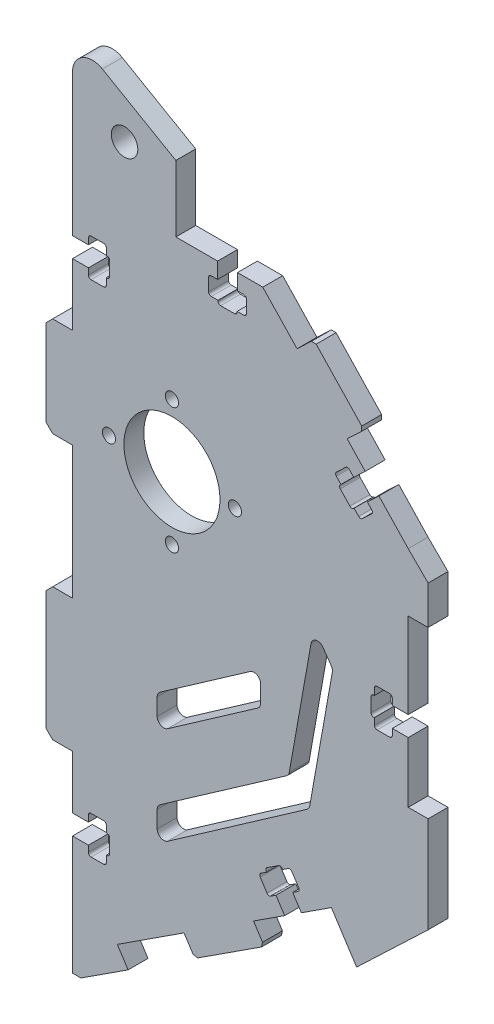
from build123d import *

# Parameters (mm, degrees)
EXTRUDE_1_DEPTH           = 3
EXTRUDE_2_DEPTH           = 3
CUT_EXTRUDE_2_DEPTH       = 10
CUT_EXTRUDE_3_DEPTH       = 10
CUT_EXTRUDE_4_DEPTH       = 10
CUT_EXTRUDE_5_DEPTH       = 10
EXTRUDE_3_DEPTH           = 3
EXTRUDE_4_DEPTH           = 3
SKETCH_12_R               = 6.95
CUT_EXTRUDE_6_DEPTH       = 10
SKETCH_15_R               = 7.25
CUT_EXTRUDE_8_DEPTH       = 10
SKETCH_16_R               = 1
CUT_EXTRUDE_9_DEPTH       = 10
SKETCH_17_W               = 8
SKETCH_17_H               = 3
CUT_EXTRUDE_10_DEPTH      = 3
CUT_EXTRUDE_11_DEPTH      = 3
SKETCH_20_W               = 3
SKETCH_20_H               = 12
EXTRUDE_6_DEPTH           = 3
EXTRUDE_8_DEPTH           = 3
SKETCH_22_W               = 3
SKETCH_22_H               = 25
CUT_EXTRUDE_12_DEPTH      = 3
SKETCH_23_W               = 3
SKETCH_23_H               = 15
SKETCH_23_H_2             = 20
EXTRUDE_9_DEPTH           = 3
CUT_EXTRUDE_15_DEPTH      = 10
FILLET_2_R                = 1
CUT_EXTRUDE_16_DEPTH      = 192.846761528
CUT_EXTRUDE_16_DEPTH_BACK = 3
CUT_EXTRUDE_17_DEPTH      = 3
CUT_EXTRUDE_18_DEPTH      = 3
CUT_EXTRUDE_19_DEPTH      = 3
SKETCH_60_W               = 12
SKETCH_60_H               = 3
CUT_EXTRUDE_51_DEPTH      = 3
EXTRUDE_10_DEPTH          = 3
EXTRUDE_11_DEPTH          = 3
SKETCH_64_R               = 2
CUT_EXTRUDE_53_DEPTH      = 150
FILLET_3_R                = 3
SKETCH_67_W               = 3
SKETCH_67_H               = 15
SKETCH_67_H_2             = 20
EXTRUDE_12_DEPTH          = 1
CHAMFER_1_SIZE            = 1
EXTRUDE_START             = -3
EXTRUDE_13_DEPTH          = 3
CUT_EXTRUDE_56_DEPTH      = 3
SKETCH_70_W               = 3
SKETCH_70_H               = 12
EXTRUDE_14_DEPTH          = 0.5
CHAMFER_4_SIZE            = 0.5
EXTRUDE_16_DEPTH          = 3
CUT_EXTRUDE_START         = -10
CUT_EXTRUDE_57_DEPTH      = 10
SKETCH_74_W               = 3.5
SKETCH_74_H               = 3
CUT_EXTRUDE_58_DEPTH      = 3
SKETCH_75_W               = 3.5
SKETCH_75_H               = 3
EXTRUDE_17_DEPTH          = 3
SKETCH_76_W               = 3.5
SKETCH_76_H               = 3
CUT_EXTRUDE_59_DEPTH      = 1
CHAMFER_5_SIZE            = 0.5
CUT_EXTRUDE_60_DEPTH      = 3
CUT_EXTRUDE_61_DEPTH      = 3


with BuildPart() as part:
    # 草图1 → 凸台-拉伸1 (new body)
    with BuildSketch(Plane.XY):
        Polygon((76.65111086, -144.127200703), (76.65111086, -91.167659031), (54.65111086, -69.167659031), (25.999999942, -69.167659031), (25.999999942, -176.167659031), (27.259933482, -176.167659031), align=None)
    extrude(amount=EXTRUDE_1_DEPTH)

    # 草图2 → 凸台-拉伸2 (add)
    with BuildSketch(Plane.XY.offset(3)):
        Polygon((76.65111086, -144.127200703), (84.65111086, -138.937535661), (84.65111086, -107.896120954), (84.65111086, -99.167659031), (76.65111086, -91.167659031), align=None)
    extrude(amount=-EXTRUDE_2_DEPTH)

    # 草图3 → 切除-拉伸2 (cut)
    with BuildSketch(Plane.XY.offset(3)):
        Polygon((82.973233852, -140.025988117), (84.65111086, -138.937535661), (84.65111086, -99.167659031), (82.65111086, -97.167659031), (82.65111086, -138.937535661), (82.65111086, -140.234951922), align=None)
    extrude(amount=-CUT_EXTRUDE_2_DEPTH, mode=Mode.SUBTRACT)

    # 草图4 → 切除-拉伸3 (cut)
    with BuildSketch(Plane.XY.offset(3)):
        Polygon((79.65111086, -94.167659031), (79.65111086, -97.167659031), (79.65111086, -142.181076312), (82.65111086, -140.234951922), (82.65111086, -97.167659031), align=None)
    extrude(amount=-CUT_EXTRUDE_3_DEPTH, mode=Mode.SUBTRACT)

    # 草图5 → 切除-拉伸4 (cut)
    with BuildSketch(Plane.XY.offset(3)):
        Polygon((78.65111086, -141.63780196), (78.65111086, -94.581872594), (78.65111086, -93.167659031), (79.65111086, -94.167659031), (79.65111086, -142.181076312), (78.65111086, -142.829784443), align=None)
    extrude(amount=-CUT_EXTRUDE_4_DEPTH, mode=Mode.SUBTRACT)

    # 草图6 → 切除-拉伸5 (cut)
    with BuildSketch(Plane.XY.offset(3)):
        Polygon((77.812172356, -143.374010671), (78.65111086, -142.829784443), (78.65111086, -93.167659031), (77.65111086, -92.167659031), (77.65111086, -93.581872594), (77.65111086, -142.28651009), (77.65111086, -143.478492573), align=None)
    extrude(amount=-CUT_EXTRUDE_5_DEPTH, mode=Mode.SUBTRACT)

    # 草图7 → 凸台-拉伸3 (add)
    with BuildSketch(Plane.XY.offset(3)):
        Polygon((79.65111086, -94.167659031), (79.65111086, -142.181076312), (77.65111086, -143.478492573), (77.65111086, -92.167659031), align=None)
    extrude(amount=-EXTRUDE_3_DEPTH)

    # 草图9 → 凸台-拉伸4 (add)
    with BuildSketch(Plane.XY.offset(3)):
        Polygon((25.999999942, -69.167659031), (55.999999942, -69.167659031), (79.65111086, -94.167659031), (79.65111086, -142.181076312), (27.259933482, -176.167659031), (25.999999942, -176.167659031), align=None)
    extrude(amount=-EXTRUDE_4_DEPTH)

    # 草图12 → 切除-拉伸6 (cut)
    with BuildSketch(Plane(origin=(-85.620742224, -166.540111436, 3), x_dir=(1, 0, 0), z_dir=(0, 0, 1))):
        with Locations((126.620742166, 63.372452405)):
            Circle(SKETCH_12_R)
    extrude(amount=-CUT_EXTRUDE_6_DEPTH, mode=Mode.SUBTRACT)

    # 草图15 → 切除-拉伸8 (cut)
    with BuildSketch(Plane.XY.offset(3)):
        with Locations((40.999999942, -103.167659031)):
            Circle(SKETCH_15_R)
    extrude(amount=-CUT_EXTRUDE_8_DEPTH, mode=Mode.SUBTRACT)

    # 草图16 → 切除-拉伸9 (cut)
    with BuildSketch(Plane.XY.offset(3)):
        with Locations((40.999999942, -112.667659031)):
            Circle(SKETCH_16_R)
        with Locations((50.499999942, -103.167659031)):
            Circle(SKETCH_16_R)
        with Locations((31.499999942, -103.167659031)):
            Circle(SKETCH_16_R)
        with Locations((40.999999942, -93.667659031)):
            Circle(SKETCH_16_R)
    extrude(amount=-CUT_EXTRUDE_9_DEPTH, mode=Mode.SUBTRACT)

    # 草图17 → 切除-拉伸10 (cut)
    with BuildSketch(Plane(origin=(0, -69.167659031, 0), x_dir=(1, 0, 0), z_dir=(0, 1, 0))):
        with Locations((29.999999942, -1.5)):
            Rectangle(SKETCH_17_W, SKETCH_17_H)
    extrude(amount=-CUT_EXTRUDE_10_DEPTH, mode=Mode.SUBTRACT)

    # 草图19 → 切除-拉伸11 (cut)
    with BuildSketch(Plane.XY.offset(3)):
        Polygon((45.999999942, -69.167659031), (45.999999942, -72.167659031), (54.7083632, -72.167659031), (76.65111086, -95.361863034), (76.65111086, -142.181076312), (76.65111086, -144.127200703), (79.65111086, -142.181076312), (79.65111086, -94.167659031), (55.999999942, -69.167659031), align=None)
    extrude(amount=-CUT_EXTRUDE_11_DEPTH, mode=Mode.SUBTRACT)

    # 草图20 → 凸台-拉伸6 (add)
    with BuildSketch(Plane(origin=(-7.158548069, -6.772304575, 0), x_dir=(0, 0, -1), z_dir=(0.726432697687951, 0.6872376122781741, 0))):
        with Locations((-1.5, -105.542592133)):
            Rectangle(SKETCH_20_W, SKETCH_20_H)
    extrude(amount=EXTRUDE_6_DEPTH)

    # 草图21 → 凸台-拉伸8 (add)
    with BuildSketch(Plane.XY.offset(3)):
        Polygon((79.65111086, -106.005849511), (79.65111086, -141.127200703), (79.65111086, -142.181076312), (76.65111086, -144.127200703), (76.65111086, -95.361863034), (79.65111086, -98.361863034), align=None)
    extrude(amount=-EXTRUDE_8_DEPTH)

    # 草图22 → 切除-拉伸12 (cut)
    with BuildSketch(Plane(origin=(-85.620742224, -166.540111436, 3), x_dir=(1, 0, 0), z_dir=(0, 0, 1))):
        with Locations((163.771853083, 49.872452405)):
            Rectangle(SKETCH_22_W, SKETCH_22_H)
        Polygon((150.676580903, 18.466910845), (138.931441854, 10.847743652), (140.564120538, 8.330928141), (152.309259588, 15.950095334), align=None)
        Polygon((120.010127201, -5.002614445), (130.077389244, 1.528100291), (128.44471056, 4.044915802), (118.377448517, -2.485798935), align=None)
    extrude(amount=-CUT_EXTRUDE_12_DEPTH, mode=Mode.SUBTRACT)

    # 草图23 → 凸台-拉伸9 (add)
    with BuildSketch(Plane.ZY.offset(-25.999999942)):
        with Locations((1.5, -99.667659031)):
            Rectangle(SKETCH_23_W, SKETCH_23_H)
        with Locations((1.5, -137.167659031)):
            Rectangle(SKETCH_23_W, SKETCH_23_H_2)
    extrude(amount=EXTRUDE_9_DEPTH)

    # 草图24 → 切除-拉伸15 (cut)
    with BuildSketch(Plane.XY.offset(3)):
        Polygon((62.409828567, -112.712939097), (65.272628358, -116.812253352), (61.717103324, -136.831405173), (38.774623861, -152.853530175), (38.774623861, -147.853530175), (58.631561343, -133.986226294), align=None)
        Polygon((54.381738207, -122.245808278), (54.381738207, -127.245808278), (38.774623861, -138.145202887), (38.774623861, -133.145202887), align=None)
    extrude(amount=-CUT_EXTRUDE_15_DEPTH, mode=Mode.SUBTRACT)

    # 圆角2
    fillet_2_edges = [part.edges().sort_by_distance(p)[0] for p in [
        (54.381738207, -122.245808278, 1.5),
        (54.381738207, -127.245808278, 1.5),
        (38.774623861, -138.145202887, 1.5),
        (38.774623861, -133.145202887, 1.5),
        (62.409828567, -112.712939097, 1.5),
        (65.272628358, -116.812253352, 1.5),
        (61.717103324, -136.831405173, 1.5),
        (38.774623861, -152.853530175, 1.5),
        (38.774623861, -147.853530175, 1.5),
        (58.631561343, -133.986226294, 1.5),
    ]]
    fillet(fillet_2_edges, radius=FILLET_2_R)

    # 草图25 → 切除-拉伸16 (cut, two sides: drawn at the far end of the back side and taken through both)
    with BuildSketch(Plane(origin=(-85.620742224, -166.540111436, 3), x_dir=(1, 0, 0), z_dir=(0, 0, 1)).offset(-CUT_EXTRUDE_16_DEPTH_BACK)):
        with BuildLine():
            Line((335.116496805, 51.619107779), (162.271853083, 51.619107779))
            Line((162.271853083, 51.619107779), (158.271853083, 51.619107779))
            Line((158.271853083, 51.619107779), (158.271853083, 53.019107779))
            ThreePointArc((158.271853083, 53.019107779), (158.183985118, 53.231239814), (157.971853083, 53.319107779))
            Line((157.971853083, 53.319107779), (155.071853083, 53.319107779))
            ThreePointArc((155.071853083, 53.319107779), (154.859721049, 53.231239814), (154.771853083, 53.019107779))
            Line((154.771853083, 53.019107779), (154.771853083, 51.569107779))
            Line((154.771853083, 51.569107779), (154.471853083, 51.569107779))
            ThreePointArc((154.471853083, 51.569107779), (154.259721049, 51.481239814), (154.171853083, 51.269107779))
            Line((154.171853083, 51.269107779), (154.171853083, 48.369107779))
            ThreePointArc((154.171853083, 48.369107779), (154.259721049, 48.156975745), (154.471853083, 48.069107779))
            Line((154.471853083, 48.069107779), (154.771853083, 48.069107779))
            Line((154.771853083, 48.069107779), (154.771853083, 46.619107779))
            ThreePointArc((154.771853083, 46.619107779), (154.859721049, 46.406975745), (155.071853083, 46.319107779))
            Line((155.071853083, 46.319107779), (157.971853083, 46.319107779))
            ThreePointArc((157.971853083, 46.319107779), (158.183985118, 46.406975745), (158.271853083, 46.619107779))
            Line((158.271853083, 46.619107779), (158.271853083, 48.019107779))
            Line((158.271853083, 48.019107779), (162.271853083, 48.019107779))
            Line((162.271853083, 48.019107779), (335.116496805, 48.019107779))
            Line((335.116496805, 48.019107779), (680.805784249, 48.019107779))
            Line((680.805784249, 48.019107779), (680.805784249, 51.619107779))
            Line((680.805784249, 51.619107779), (335.116496805, 51.619107779))
        make_face()
    extrude(amount=CUT_EXTRUDE_16_DEPTH + CUT_EXTRUDE_16_DEPTH_BACK, mode=Mode.SUBTRACT)

    # 草图26 → 切除-拉伸17 (cut)
    with BuildSketch(Plane(origin=(-85.620742224, -166.540111436, 3), x_dir=(1, 0, 0), z_dir=(0, 0, 1))):
        with BuildLine():
            Line((144.698749764, 17.568999389), (146.059315334, 15.47165313))
            Line((146.059315334, 15.47165313), (143.710287524, 13.947819691))
            Line((143.710287524, 13.947819691), (142.349721954, 16.04516595))
            Line((142.349721954, 16.04516595), (141.468836525, 15.473728411))
            ThreePointArc((141.468836525, 15.473728411), (141.243050742, 15.431996413), (141.053887105, 15.562142093))
            Line((141.053887105, 15.562142093), (140.019857272, 17.15612525))
            ThreePointArc((140.019857272, 17.15612525), (139.978125275, 17.381911033), (140.108270955, 17.57107467))
            Line((140.108270955, 17.57107467), (141.031103309, 18.16972352))
            Line((141.031103309, 18.16972352), (140.922258063, 18.337511221))
            ThreePointArc((140.922258063, 18.337511221), (140.880526066, 18.563297004), (141.010671746, 18.752460641))
            Line((141.010671746, 18.752460641), (142.772442603, 19.89533572))
            ThreePointArc((142.772442603, 19.89533572), (142.998228386, 19.937067717), (143.187392023, 19.806922037))
            Line((143.187392023, 19.806922037), (143.296237268, 19.639134336))
            Line((143.296237268, 19.639134336), (144.219069622, 20.237783187))
            ThreePointArc((144.219069622, 20.237783187), (144.444855405, 20.279515184), (144.634019042, 20.149369504))
            Line((144.634019042, 20.149369504), (145.668048875, 18.555386348))
            ThreePointArc((145.668048875, 18.555386348), (145.709780872, 18.329600565), (145.579635192, 18.140436928))
            Line((145.579635192, 18.140436928), (144.698749764, 17.568999389))
        make_face()
    extrude(amount=-CUT_EXTRUDE_17_DEPTH, mode=Mode.SUBTRACT)

    # 草图27 → 切除-拉伸18 (cut)
    with BuildSketch(Plane(origin=(-85.620742224, -166.540111436, 0), x_dir=(-1, 0, 0), z_dir=(0, 0, -1))):
        with BuildLine():
            Line((-114.120742166, 8.402522263), (-111.620742166, 8.402522263))
            Line((-111.620742166, 8.402522263), (-111.620742166, 11.202522263))
            Line((-111.620742166, 11.202522263), (-114.120742166, 11.202522263))
            Line((-114.120742166, 11.202522263), (-114.120742166, 12.252522263))
            ThreePointArc((-114.120742166, 12.252522263), (-114.208610132, 12.464654297), (-114.420742166, 12.552522263))
            Line((-114.420742166, 12.552522263), (-116.320742166, 12.552522263))
            ThreePointArc((-116.320742166, 12.552522263), (-116.5328742, 12.464654297), (-116.620742166, 12.252522263))
            Line((-116.620742166, 12.252522263), (-116.620742166, 11.152522263))
            Line((-116.620742166, 11.152522263), (-116.820742166, 11.152522263))
            ThreePointArc((-116.820742166, 11.152522263), (-117.0328742, 11.064654297), (-117.120742166, 10.852522263))
            Line((-117.120742166, 10.852522263), (-117.120742166, 8.752522263))
            ThreePointArc((-117.120742166, 8.752522263), (-117.0328742, 8.540390228), (-116.820742166, 8.452522263))
            Line((-116.820742166, 8.452522263), (-116.620742166, 8.452522263))
            Line((-116.620742166, 8.452522263), (-116.620742166, 7.352522263))
            ThreePointArc((-116.620742166, 7.352522263), (-116.5328742, 7.140390228), (-116.320742166, 7.052522263))
            Line((-116.320742166, 7.052522263), (-114.420742166, 7.052522263))
            ThreePointArc((-114.420742166, 7.052522263), (-114.208610132, 7.140390228), (-114.120742166, 7.352522263))
            Line((-114.120742166, 7.352522263), (-114.120742166, 8.402522263))
        make_face()
        with BuildLine():
            Line((-114.120742166, 83.845595622), (-111.620742166, 83.845595622))
            Line((-111.620742166, 83.845595622), (-111.620742166, 86.645595622))
            Line((-111.620742166, 86.645595622), (-114.120742166, 86.645595622))
            Line((-114.120742166, 86.645595622), (-114.120742166, 87.695595622))
            ThreePointArc((-114.120742166, 87.695595622), (-114.208610132, 87.907727656), (-114.420742166, 87.995595622))
            Line((-114.420742166, 87.995595622), (-116.320742166, 87.995595622))
            ThreePointArc((-116.320742166, 87.995595622), (-116.5328742, 87.907727656), (-116.620742166, 87.695595622))
            Line((-116.620742166, 87.695595622), (-116.620742166, 86.595595622))
            Line((-116.620742166, 86.595595622), (-116.820742166, 86.595595622))
            ThreePointArc((-116.820742166, 86.595595622), (-117.0328742, 86.507727656), (-117.120742166, 86.295595622))
            Line((-117.120742166, 86.295595622), (-117.120742166, 84.195595622))
            ThreePointArc((-117.120742166, 84.195595622), (-117.0328742, 83.983463588), (-116.820742166, 83.895595622))
            Line((-116.820742166, 83.895595622), (-116.620742166, 83.895595622))
            Line((-116.620742166, 83.895595622), (-116.620742166, 82.795595622))
            ThreePointArc((-116.620742166, 82.795595622), (-116.5328742, 82.583463588), (-116.320742166, 82.495595622))
            Line((-116.320742166, 82.495595622), (-114.420742166, 82.495595622))
            ThreePointArc((-114.420742166, 82.495595622), (-114.208610132, 82.583463588), (-114.120742166, 82.795595622))
            Line((-114.120742166, 82.795595622), (-114.120742166, 83.845595622))
        make_face()
    extrude(amount=-CUT_EXTRUDE_18_DEPTH, mode=Mode.SUBTRACT)

    # 草图28 → 切除-拉伸19 (cut)
    with BuildSketch(Plane(origin=(-85.620742224, -166.540111436, 0), x_dir=(-1, 0, 0), z_dir=(0, 0, -1))):
        with BuildLine():
            Line((-136.408876052, 91.872452405), (-136.408876052, 94.372452405))
            Line((-136.408876052, 94.372452405), (-133.608876052, 94.372452405))
            Line((-133.608876052, 94.372452405), (-133.608876052, 91.872452405))
            Line((-133.608876052, 91.872452405), (-132.558876052, 91.872452405))
            ThreePointArc((-132.558876052, 91.872452405), (-132.346744018, 91.784584439), (-132.258876052, 91.572452405))
            Line((-132.258876052, 91.572452405), (-132.258876052, 89.672452405))
            ThreePointArc((-132.258876052, 89.672452405), (-132.346744018, 89.460320371), (-132.558876052, 89.372452405))
            Line((-132.558876052, 89.372452405), (-133.658876052, 89.372452405))
            Line((-133.658876052, 89.372452405), (-133.658876052, 89.172452405))
            ThreePointArc((-133.658876052, 89.172452405), (-133.746744018, 88.960320371), (-133.958876052, 88.872452405))
            Line((-133.958876052, 88.872452405), (-136.058876052, 88.872452405))
            ThreePointArc((-136.058876052, 88.872452405), (-136.271008086, 88.960320371), (-136.358876052, 89.172452405))
            Line((-136.358876052, 89.172452405), (-136.358876052, 89.372452405))
            Line((-136.358876052, 89.372452405), (-137.458876052, 89.372452405))
            ThreePointArc((-137.458876052, 89.372452405), (-137.671008086, 89.460320371), (-137.758876052, 89.672452405))
            Line((-137.758876052, 89.672452405), (-137.758876052, 91.572452405))
            ThreePointArc((-137.758876052, 91.572452405), (-137.671008086, 91.784584439), (-137.458876052, 91.872452405))
            Line((-137.458876052, 91.872452405), (-136.408876052, 91.872452405))
        make_face()
    extrude(amount=-CUT_EXTRUDE_19_DEPTH, mode=Mode.SUBTRACT)

    # 草图60 → 切除-拉伸51 (cut)
    with BuildSketch(Plane(origin=(0, -69.167659031, 0), x_dir=(1, 0, 0), z_dir=(0, 1, 0))):
        with Locations((39.999999942, -1.5)):
            Rectangle(SKETCH_60_W, SKETCH_60_H)
    extrude(amount=-CUT_EXTRUDE_51_DEPTH, mode=Mode.SUBTRACT)

    # 草图61 → 凸台-拉伸10 (add)
    with BuildSketch(Plane(origin=(0, 0, 0), x_dir=(-1, 0, 0), z_dir=(0, 0, -1))):
        Polygon((-25.999999942, -72.167659031), (-25.999999942, -54.167659031), (-41.58845721, -63.167659031), (-41.58845721, -72.167659031), align=None)
    extrude(amount=-EXTRUDE_10_DEPTH)

    # 草图62 → 凸台-拉伸11 (add)
    with BuildSketch(Plane(origin=(0, 0, 0), x_dir=(-1, 0, 0), z_dir=(0, 0, -1))):
        Polygon((-25.999999942, -54.167659031), (-25.999999942, -53.167659031), (-41.58845721, -62.167659031), (-41.58845721, -63.167659031), align=None)
    extrude(amount=-EXTRUDE_11_DEPTH)

    # 草图64 → 切除-拉伸53 (cut)
    with BuildSketch(Plane(origin=(-85.620742224, -166.540111436, -5), x_dir=(-1, 0, 0), z_dir=(0, 0, -1))):
        with Locations((-119.468439353, 102.928528754)):
            Circle(SKETCH_64_R)
    extrude(amount=-CUT_EXTRUDE_53_DEPTH, mode=Mode.SUBTRACT)

    # 圆角3
    fillet_3_edges = [part.edges().sort_by_distance(p)[0] for p in [
        (25.999999942, -53.167659031, 1.5),
    ]]
    fillet(fillet_3_edges, radius=FILLET_3_R)

    # 草图67 → 凸台-拉伸12 (add)
    with BuildSketch(Plane.ZY.offset(-22.999999942)):
        with Locations((1.5, -99.667659031)):
            Rectangle(SKETCH_67_W, SKETCH_67_H)
        with Locations((1.5, -137.167659031)):
            Rectangle(SKETCH_67_W, SKETCH_67_H_2)
    extrude(amount=EXTRUDE_12_DEPTH)

    # 倒角1
    chamfer_1_edges = [part.edges().sort_by_distance(p)[0] for p in [
        (21.999999942, -107.167659031, 1.5),
        (21.999999942, -92.167659031, 1.5),
        (21.999999942, -127.167659031, 1.5),
        (21.999999942, -147.167659031, 1.5),
    ]]
    chamfer(chamfer_1_edges, length=CHAMFER_1_SIZE)

    # 草图68 → 凸台-拉伸13 (add)
    with BuildSketch(Plane.XY.offset(3).offset(EXTRUDE_START)):
        with BuildLine():
            Line((76.65111086, -114.921003657), (72.65111086, -114.921003657))
            Line((72.65111086, -114.921003657), (72.65111086, -113.521003657))
            ThreePointArc((72.65111086, -113.521003657), (72.563242894, -113.308871623), (72.35111086, -113.221003657))
            Line((72.35111086, -113.221003657), (69.45111086, -113.221003657))
            ThreePointArc((69.45111086, -113.221003657), (69.238978825, -113.308871623), (69.15111086, -113.521003657))
            Line((69.15111086, -113.521003657), (69.15111086, -114.971003657))
            Line((69.15111086, -114.971003657), (68.85111086, -114.971003657))
            ThreePointArc((68.85111086, -114.971003657), (68.638978825, -115.058871623), (68.55111086, -115.271003657))
            Line((68.55111086, -115.271003657), (68.55111086, -118.171003657))
            ThreePointArc((68.55111086, -118.171003657), (68.638978825, -118.383135691), (68.85111086, -118.471003657))
            Line((68.85111086, -118.471003657), (69.15111086, -118.471003657))
            Line((69.15111086, -118.471003657), (69.15111086, -119.921003657))
            ThreePointArc((69.15111086, -119.921003657), (69.238978825, -120.133135691), (69.45111086, -120.221003657))
            Line((69.45111086, -120.221003657), (72.35111086, -120.221003657))
            ThreePointArc((72.35111086, -120.221003657), (72.563242894, -120.133135691), (72.65111086, -119.921003657))
            Line((72.65111086, -119.921003657), (72.65111086, -118.521003657))
            Line((72.65111086, -118.521003657), (76.65111086, -118.521003657))
            Line((76.65111086, -118.521003657), (76.65111086, -114.921003657))
        make_face()
    extrude(amount=EXTRUDE_13_DEPTH)

    # 草图69 → 切除-拉伸56 (cut)
    with BuildSketch(Plane(origin=(-85.620742224, -166.540111436, 3), x_dir=(1, 0, 0), z_dir=(0, 0, 1))):
        with BuildLine():
            Line((162.271853083, 49.387065257), (159.771853083, 49.387065257))
            Line((159.771853083, 49.387065257), (159.771853083, 50.437065257))
            ThreePointArc((159.771853083, 50.437065257), (159.683985118, 50.649197291), (159.471853083, 50.737065257))
            Line((159.471853083, 50.737065257), (157.571853083, 50.737065257))
            ThreePointArc((157.571853083, 50.737065257), (157.359721049, 50.649197291), (157.271853083, 50.437065257))
            Line((157.271853083, 50.437065257), (157.271853083, 49.337065257))
            Line((157.271853083, 49.337065257), (157.071853083, 49.337065257))
            ThreePointArc((157.071853083, 49.337065257), (156.859721049, 49.249197291), (156.771853083, 49.037065257))
            Line((156.771853083, 49.037065257), (156.771853083, 46.937065257))
            ThreePointArc((156.771853083, 46.937065257), (156.859721049, 46.724933222), (157.071853083, 46.637065257))
            Line((157.071853083, 46.637065257), (157.271853083, 46.637065257))
            Line((157.271853083, 46.637065257), (157.271853083, 45.537065257))
            ThreePointArc((157.271853083, 45.537065257), (157.359721049, 45.324933222), (157.571853083, 45.237065257))
            Line((157.571853083, 45.237065257), (159.471853083, 45.237065257))
            ThreePointArc((159.471853083, 45.237065257), (159.683985118, 45.324933222), (159.771853083, 45.537065257))
            Line((159.771853083, 45.537065257), (159.771853083, 46.587065257))
            Line((159.771853083, 46.587065257), (162.271853083, 46.587065257))
            Line((162.271853083, 46.587065257), (162.271853083, 49.387065257))
        make_face()
    extrude(amount=-CUT_EXTRUDE_56_DEPTH, mode=Mode.SUBTRACT)

    # 草图70 → 凸台-拉伸14 (add)
    with BuildSketch(Plane(origin=(-4.979249976, -4.710591738, 0), x_dir=(0, 0, -1), z_dir=(0.7264326976879508, 0.6872376122781745, 0))):
        with Locations((-1.5, -105.542592133)):
            Rectangle(SKETCH_70_W, SKETCH_70_H)
    extrude(amount=EXTRUDE_14_DEPTH)

    # 倒角4
    chamfer_4_edges = [part.edges().sort_by_distance(p)[0] for p in [
        (54.943378314, -158.209183295, 1.5),
        (44.45664702, -165.012011145, 1.5),
    ]]
    chamfer(chamfer_4_edges, length=CHAMFER_4_SIZE)

    # 草图72 → 凸台-拉伸16 (add)
    with BuildSketch(Plane.XY.offset(3)):
        Polygon((79.65111086, -142.181076312), (79.65111086, -143.681076312), (68.865422276, -153.945770117), (66.688517364, -150.590016102), align=None)
    extrude(amount=-EXTRUDE_16_DEPTH)

    # 草图73 → 切除-拉伸57 (cut)
    with BuildSketch(Plane.XY.offset(3).offset(CUT_EXTRUDE_START)):
        with BuildLine():
            Line((52.138133828, -74.967659031), (52.138133828, -76.867659031))
            ThreePointArc((52.138133828, -76.867659031), (52.050265862, -77.079791066), (51.838133828, -77.167659031))
            Line((51.838133828, -77.167659031), (50.738133828, -77.167659031))
            Line((50.738133828, -77.167659031), (50.738133828, -77.367659031))
            ThreePointArc((50.738133828, -77.367659031), (50.650265862, -77.579791066), (50.438133828, -77.667659031))
            Line((50.438133828, -77.667659031), (48.338133828, -77.667659031))
            ThreePointArc((48.338133828, -77.667659031), (48.126001794, -77.579791066), (48.038133828, -77.367659031))
            Line((48.038133828, -77.367659031), (48.038133828, -77.167659031))
            Line((48.038133828, -77.167659031), (46.938133828, -77.167659031))
            ThreePointArc((46.938133828, -77.167659031), (46.726001794, -77.079791066), (46.638133828, -76.867659031))
            Line((46.638133828, -76.867659031), (46.638133828, -74.967659031))
            ThreePointArc((46.638133828, -74.967659031), (46.726001794, -74.755526997), (46.938133828, -74.667659031))
            Line((46.938133828, -74.667659031), (47.988133828, -74.667659031))
            Line((47.988133828, -74.667659031), (47.988133828, -72.167659031))
            Line((47.988133828, -72.167659031), (47.888133828, -72.167659031))
            Line((47.888133828, -72.167659031), (47.888133828, -74.567659031))
            Line((47.888133828, -74.567659031), (46.938133828, -74.567659031))
            ThreePointArc((46.938133828, -74.567659031), (46.655291116, -74.684816319), (46.538133828, -74.967659031))
            Line((46.538133828, -74.967659031), (46.538133828, -76.867659031))
            ThreePointArc((46.538133828, -76.867659031), (46.655291116, -77.150501744), (46.938133828, -77.267659031))
            Line((46.938133828, -77.267659031), (47.938133828, -77.267659031))
            Line((47.938133828, -77.267659031), (47.938133828, -77.367659031))
            ThreePointArc((47.938133828, -77.367659031), (48.055291116, -77.650501744), (48.338133828, -77.767659031))
            Line((48.338133828, -77.767659031), (50.438133828, -77.767659031))
            ThreePointArc((50.438133828, -77.767659031), (50.720976541, -77.650501744), (50.838133828, -77.367659031))
            Line((50.838133828, -77.367659031), (50.838133828, -77.267659031))
            Line((50.838133828, -77.267659031), (51.838133828, -77.267659031))
            ThreePointArc((51.838133828, -77.267659031), (52.120976541, -77.150501744), (52.238133828, -76.867659031))
            Line((52.238133828, -76.867659031), (52.238133828, -74.967659031))
            ThreePointArc((52.238133828, -74.967659031), (52.120976541, -74.684816319), (51.838133828, -74.567659031))
            Line((51.838133828, -74.567659031), (50.888133828, -74.567659031))
            Line((50.888133828, -74.567659031), (50.888133828, -72.167659031))
            Line((50.888133828, -72.167659031), (50.788133828, -72.167659031))
            Line((50.788133828, -72.167659031), (50.788133828, -74.667659031))
            Line((50.788133828, -74.667659031), (51.838133828, -74.667659031))
            ThreePointArc((51.838133828, -74.667659031), (52.050265862, -74.755526997), (52.138133828, -74.967659031))
        make_face()
        with BuildLine():
            Line((25.999999942, -79.894515814), (28.499999942, -79.894515814))
            Line((28.499999942, -79.894515814), (28.499999942, -78.844515814))
            ThreePointArc((28.499999942, -78.844515814), (28.587867908, -78.63238378), (28.799999942, -78.544515814))
            Line((28.799999942, -78.544515814), (30.699999942, -78.544515814))
            ThreePointArc((30.699999942, -78.544515814), (30.912131977, -78.63238378), (30.999999942, -78.844515814))
            Line((30.999999942, -78.844515814), (30.999999942, -79.944515814))
            Line((30.999999942, -79.944515814), (31.199999942, -79.944515814))
            ThreePointArc((31.199999942, -79.944515814), (31.412131977, -80.03238378), (31.499999942, -80.244515814))
            Line((31.499999942, -80.244515814), (31.499999942, -82.344515814))
            ThreePointArc((31.499999942, -82.344515814), (31.412131977, -82.556647849), (31.199999942, -82.644515814))
            Line((31.199999942, -82.644515814), (30.999999942, -82.644515814))
            Line((30.999999942, -82.644515814), (30.999999942, -83.744515814))
            ThreePointArc((30.999999942, -83.744515814), (30.912131977, -83.956647849), (30.699999942, -84.044515814))
            Line((30.699999942, -84.044515814), (28.799999942, -84.044515814))
            ThreePointArc((28.799999942, -84.044515814), (28.587867908, -83.956647849), (28.499999942, -83.744515814))
            Line((28.499999942, -83.744515814), (28.499999942, -82.694515814))
            Line((28.499999942, -82.694515814), (25.999999942, -82.694515814))
            Line((25.999999942, -82.694515814), (25.999999942, -82.794515814))
            Line((25.999999942, -82.794515814), (28.399999942, -82.794515814))
            Line((28.399999942, -82.794515814), (28.399999942, -83.744515814))
            ThreePointArc((28.399999942, -83.744515814), (28.51715723, -84.027358527), (28.799999942, -84.144515814))
            Line((28.799999942, -84.144515814), (30.699999942, -84.144515814))
            ThreePointArc((30.699999942, -84.144515814), (30.982842655, -84.027358527), (31.099999942, -83.744515814))
            Line((31.099999942, -83.744515814), (31.099999942, -82.744515814))
            Line((31.099999942, -82.744515814), (31.199999942, -82.744515814))
            ThreePointArc((31.199999942, -82.744515814), (31.482842655, -82.627358527), (31.599999942, -82.344515814))
            Line((31.599999942, -82.344515814), (31.599999942, -80.244515814))
            ThreePointArc((31.599999942, -80.244515814), (31.482842655, -79.961673102), (31.199999942, -79.844515814))
            Line((31.199999942, -79.844515814), (31.099999942, -79.844515814))
            Line((31.099999942, -79.844515814), (31.099999942, -78.844515814))
            ThreePointArc((31.099999942, -78.844515814), (30.982842655, -78.561673102), (30.699999942, -78.444515814))
            Line((30.699999942, -78.444515814), (28.799999942, -78.444515814))
            ThreePointArc((28.799999942, -78.444515814), (28.51715723, -78.561673102), (28.399999942, -78.844515814))
            Line((28.399999942, -78.844515814), (28.399999942, -79.794515814))
            Line((28.399999942, -79.794515814), (25.999999942, -79.794515814))
            Line((25.999999942, -79.794515814), (25.999999942, -79.894515814))
        make_face()
        with BuildLine():
            Line((25.999999942, -155.337589174), (28.499999942, -155.337589174))
            Line((28.499999942, -155.337589174), (28.499999942, -154.287589174))
            ThreePointArc((28.499999942, -154.287589174), (28.587867908, -154.07545714), (28.799999942, -153.987589174))
            Line((28.799999942, -153.987589174), (30.699999942, -153.987589174))
            ThreePointArc((30.699999942, -153.987589174), (30.912131977, -154.07545714), (30.999999942, -154.287589174))
            Line((30.999999942, -154.287589174), (30.999999942, -155.387589174))
            Line((30.999999942, -155.387589174), (31.199999942, -155.387589174))
            ThreePointArc((31.199999942, -155.387589174), (31.412131977, -155.47545714), (31.499999942, -155.687589174))
            Line((31.499999942, -155.687589174), (31.499999942, -157.787589174))
            ThreePointArc((31.499999942, -157.787589174), (31.412131977, -157.999721208), (31.199999942, -158.087589174))
            Line((31.199999942, -158.087589174), (30.999999942, -158.087589174))
            Line((30.999999942, -158.087589174), (30.999999942, -159.187589174))
            ThreePointArc((30.999999942, -159.187589174), (30.912131977, -159.399721208), (30.699999942, -159.487589174))
            Line((30.699999942, -159.487589174), (28.799999942, -159.487589174))
            ThreePointArc((28.799999942, -159.487589174), (28.587867908, -159.399721208), (28.499999942, -159.187589174))
            Line((28.499999942, -159.187589174), (28.499999942, -158.137589174))
            Line((28.499999942, -158.137589174), (25.999999942, -158.137589174))
            Line((25.999999942, -158.137589174), (25.999999942, -158.237589174))
            Line((25.999999942, -158.237589174), (28.399999942, -158.237589174))
            Line((28.399999942, -158.237589174), (28.399999942, -159.187589174))
            ThreePointArc((28.399999942, -159.187589174), (28.51715723, -159.470431886), (28.799999942, -159.587589174))
            Line((28.799999942, -159.587589174), (30.699999942, -159.587589174))
            ThreePointArc((30.699999942, -159.587589174), (30.982842655, -159.470431886), (31.099999942, -159.187589174))
            Line((31.099999942, -159.187589174), (31.099999942, -158.187589174))
            Line((31.099999942, -158.187589174), (31.199999942, -158.187589174))
            ThreePointArc((31.199999942, -158.187589174), (31.482842655, -158.070431886), (31.599999942, -157.787589174))
            Line((31.599999942, -157.787589174), (31.599999942, -155.687589174))
            ThreePointArc((31.599999942, -155.687589174), (31.482842655, -155.404746461), (31.199999942, -155.287589174))
            Line((31.199999942, -155.287589174), (31.099999942, -155.287589174))
            Line((31.099999942, -155.287589174), (31.099999942, -154.287589174))
            ThreePointArc((31.099999942, -154.287589174), (30.982842655, -154.004746461), (30.699999942, -153.887589174))
            Line((30.699999942, -153.887589174), (28.799999942, -153.887589174))
            ThreePointArc((28.799999942, -153.887589174), (28.51715723, -154.004746461), (28.399999942, -154.287589174))
            Line((28.399999942, -154.287589174), (28.399999942, -155.237589174))
            Line((28.399999942, -155.237589174), (25.999999942, -155.237589174))
            Line((25.999999942, -155.237589174), (25.999999942, -155.337589174))
        make_face()
        with BuildLine():
            Line((56.72897973, -150.494945486), (58.0895453, -152.592291745))
            Line((58.0895453, -152.592291745), (58.00565145, -152.646714368))
            Line((58.00565145, -152.646714368), (56.699508502, -150.633261959))
            Line((56.699508502, -150.633261959), (55.902516924, -151.150276876))
            ThreePointArc((55.902516924, -151.150276876), (55.601469213, -151.205919539), (55.349251031, -151.032391966))
            Line((55.349251031, -151.032391966), (54.315221198, -149.438408809))
            ThreePointArc((54.315221198, -149.438408809), (54.259578535, -149.137361098), (54.433106108, -148.885142916))
            Line((54.433106108, -148.885142916), (55.272044612, -148.340916688))
            Line((55.272044612, -148.340916688), (55.217621989, -148.257022838))
            ThreePointArc((55.217621989, -148.257022838), (55.161979326, -147.955975127), (55.335506899, -147.703756945))
            Line((55.335506899, -147.703756945), (57.097277757, -146.560881867))
            ThreePointArc((57.097277757, -146.560881867), (57.398325467, -146.505239203), (57.650543649, -146.678766777))
            Line((57.650543649, -146.678766777), (57.704966272, -146.762660627))
            Line((57.704966272, -146.762660627), (58.543904776, -146.218434399))
            ThreePointArc((58.543904776, -146.218434399), (58.844952486, -146.162791736), (59.097170668, -146.336319309))
            Line((59.097170668, -146.336319309), (60.131200501, -147.930302466))
            ThreePointArc((60.131200501, -147.930302466), (60.186843165, -148.231350177), (60.013315591, -148.483568359))
            Line((60.013315591, -148.483568359), (59.216324013, -149.000583275))
            Line((59.216324013, -149.000583275), (60.52246696, -151.014035684))
            Line((60.52246696, -151.014035684), (60.43857311, -151.068458307))
            Line((60.43857311, -151.068458307), (59.07800754, -148.971112048))
            Line((59.07800754, -148.971112048), (59.958892968, -148.399674508))
            ThreePointArc((59.958892968, -148.399674508), (60.089038648, -148.210510872), (60.047306651, -147.984725089))
            Line((60.047306651, -147.984725089), (59.013276818, -146.390741932))
            ThreePointArc((59.013276818, -146.390741932), (58.824113181, -146.260596252), (58.598327398, -146.302328249))
            Line((58.598327398, -146.302328249), (57.675495044, -146.9009771))
            Line((57.675495044, -146.9009771), (57.566649799, -146.7331894))
            ThreePointArc((57.566649799, -146.7331894), (57.377486162, -146.60304372), (57.151700379, -146.644775717))
            Line((57.151700379, -146.644775717), (55.389929522, -147.787650796))
            ThreePointArc((55.389929522, -147.787650796), (55.259783842, -147.976814432), (55.301515839, -148.202600215))
            Line((55.301515839, -148.202600215), (55.410361085, -148.370387916))
            Line((55.410361085, -148.370387916), (54.487528731, -148.969036767))
            ThreePointArc((54.487528731, -148.969036767), (54.357383051, -149.158200403), (54.399115048, -149.383986186))
            Line((54.399115048, -149.383986186), (55.433144882, -150.977969343))
            ThreePointArc((55.433144882, -150.977969343), (55.622308518, -151.108115023), (55.848094301, -151.066383026))
            Line((55.848094301, -151.066383026), (56.72897973, -150.494945486))
        make_face()
        with BuildLine():
            Line((74.15111086, -119.95304618), (76.65111086, -119.95304618))
            Line((76.65111086, -119.95304618), (76.65111086, -120.05304618))
            Line((76.65111086, -120.05304618), (74.25111086, -120.05304618))
            Line((74.25111086, -120.05304618), (74.25111086, -121.00304618))
            ThreePointArc((74.25111086, -121.00304618), (74.133953572, -121.285888892), (73.85111086, -121.40304618))
            Line((73.85111086, -121.40304618), (71.95111086, -121.40304618))
            ThreePointArc((71.95111086, -121.40304618), (71.668268147, -121.285888892), (71.55111086, -121.00304618))
            Line((71.55111086, -121.00304618), (71.55111086, -120.00304618))
            Line((71.55111086, -120.00304618), (71.45111086, -120.00304618))
            ThreePointArc((71.45111086, -120.00304618), (71.168268147, -119.885888892), (71.05111086, -119.60304618))
            Line((71.05111086, -119.60304618), (71.05111086, -117.50304618))
            ThreePointArc((71.05111086, -117.50304618), (71.168268147, -117.220203467), (71.45111086, -117.10304618))
            Line((71.45111086, -117.10304618), (71.55111086, -117.10304618))
            Line((71.55111086, -117.10304618), (71.55111086, -116.10304618))
            ThreePointArc((71.55111086, -116.10304618), (71.668268147, -115.820203467), (71.95111086, -115.70304618))
            Line((71.95111086, -115.70304618), (73.85111086, -115.70304618))
            ThreePointArc((73.85111086, -115.70304618), (74.133953572, -115.820203467), (74.25111086, -116.10304618))
            Line((74.25111086, -116.10304618), (74.25111086, -117.05304618))
            Line((74.25111086, -117.05304618), (76.65111086, -117.05304618))
            Line((76.65111086, -117.05304618), (76.65111086, -117.15304618))
            Line((76.65111086, -117.15304618), (74.15111086, -117.15304618))
            Line((74.15111086, -117.15304618), (74.15111086, -116.10304618))
            ThreePointArc((74.15111086, -116.10304618), (74.063242894, -115.890914146), (73.85111086, -115.80304618))
            Line((73.85111086, -115.80304618), (71.95111086, -115.80304618))
            ThreePointArc((71.95111086, -115.80304618), (71.738978825, -115.890914146), (71.65111086, -116.10304618))
            Line((71.65111086, -116.10304618), (71.65111086, -117.20304618))
            Line((71.65111086, -117.20304618), (71.45111086, -117.20304618))
            ThreePointArc((71.45111086, -117.20304618), (71.238978825, -117.290914146), (71.15111086, -117.50304618))
            Line((71.15111086, -117.50304618), (71.15111086, -119.60304618))
            ThreePointArc((71.15111086, -119.60304618), (71.238978825, -119.815178214), (71.45111086, -119.90304618))
            Line((71.45111086, -119.90304618), (71.65111086, -119.90304618))
            Line((71.65111086, -119.90304618), (71.65111086, -121.00304618))
            ThreePointArc((71.65111086, -121.00304618), (71.738978825, -121.215178214), (71.95111086, -121.30304618))
            Line((71.95111086, -121.30304618), (73.85111086, -121.30304618))
            ThreePointArc((73.85111086, -121.30304618), (74.063242894, -121.215178214), (74.15111086, -121.00304618))
            Line((74.15111086, -121.00304618), (74.15111086, -119.95304618))
        make_face()
    extrude(amount=CUT_EXTRUDE_57_DEPTH, mode=Mode.SUBTRACT)

    # 草图74 → 切除-拉伸58 (cut)
    with BuildSketch(Plane(origin=(76.656264685, -81.02818611, 0), x_dir=(0.7264326976879509, 0.6872376122781741, 0), z_dir=(0.6872376122781741, -0.7264326976879509, 0))):
        with Locations((-8.104385811, 1.5)):
            Rectangle(SKETCH_74_W, SKETCH_74_H)
    extrude(amount=-CUT_EXTRUDE_58_DEPTH, mode=Mode.SUBTRACT)

    # 草图75 → 凸台-拉伸17 (add)
    with BuildSketch(Plane(origin=(68.409413338, -72.310993738, 0), x_dir=(0.7264326976879509, 0.6872376122781741, 0), z_dir=(-0.6872376122781741, 0.7264326976879509, 0))):
        with Locations((-8.104385811, -1.5)):
            Rectangle(SKETCH_75_W, SKETCH_75_H)
    extrude(amount=EXTRUDE_17_DEPTH)

    # 草图76 → 切除-拉伸59 (cut)
    with BuildSketch(Plane(origin=(66.347700501, -70.131695645, 0), x_dir=(0.7264326976879497, 0.6872376122781756, -1.675321697979709e-15), z_dir=(-0.6872376122781756, 0.7264326976879497, -1.7708699855996005e-15))):
        with Locations((-8.104385811, -1.5)):
            Rectangle(SKETCH_76_W, SKETCH_76_H)
    extrude(amount=-CUT_EXTRUDE_59_DEPTH, mode=Mode.SUBTRACT)

    # 倒角5
    chamfer_5_edges = [part.edges().sort_by_distance(p)[0] for p in [
        (69.978518221, -83.21586095, 1.5),
        (62.418904486, -75.225101275, 1.5),
    ]]
    chamfer(chamfer_5_edges, length=CHAMFER_5_SIZE)

    # 草图77 → 切除-拉伸60 (cut)
    with BuildSketch(Plane(origin=(-85.620742224, -166.540111436, 3), x_dir=(1, 0, 0), z_dir=(0, 0, 1))):
        with BuildLine():
            Line((154.043112899, 76.23854468), (153.321513406, 77.001299012))
            ThreePointArc((153.321513406, 77.001299012), (153.11189813, 77.095012488), (152.897412313, 77.013057538))
            Line((152.897412313, 77.013057538), (151.517190187, 75.707306075))
            ThreePointArc((151.517190187, 75.707306075), (151.423476712, 75.497690799), (151.505431662, 75.283204982))
            Line((151.505431662, 75.283204982), (152.261393035, 74.484129014))
            Line((152.261393035, 74.484129014), (152.116106496, 74.346681492))
            ThreePointArc((152.116106496, 74.346681492), (152.022393021, 74.137066216), (152.10434797, 73.922580399))
            Line((152.10434797, 73.922580399), (153.547546956, 72.397071734))
            ThreePointArc((153.547546956, 72.397071734), (153.757162232, 72.303358259), (153.971648049, 72.385313208))
            Line((153.971648049, 72.385313208), (154.116934588, 72.522760731))
            Line((154.116934588, 72.522760731), (154.872895962, 71.723684763))
            ThreePointArc((154.872895962, 71.723684763), (155.082511238, 71.629971288), (155.296997055, 71.711926238))
            Line((155.296997055, 71.711926238), (156.67721918, 73.017677701))
            ThreePointArc((156.67721918, 73.017677701), (156.770932655, 73.227292977), (156.688977706, 73.441778794))
            Line((156.688977706, 73.441778794), (155.967378213, 74.204533126))
            Line((155.967378213, 74.204533126), (157.783459957, 75.922627157))
            Line((157.783459957, 75.922627157), (155.859194643, 77.956638711))
            Line((155.859194643, 77.956638711), (154.043112899, 76.23854468))
        make_face()
    extrude(amount=-CUT_EXTRUDE_60_DEPTH, mode=Mode.SUBTRACT)

    # 草图78 → 切除-拉伸61 (cut)
    with BuildSketch(Plane.XY.offset(3)):
        with BuildLine():
            Line((70.346635989, -92.33557831), (72.162717734, -90.617484279))
            Line((72.162717734, -90.617484279), (72.231441495, -90.690127549))
            Line((72.231441495, -90.690127549), (70.48800302, -92.339497819))
            Line((70.48800302, -92.339497819), (71.140878752, -93.029608881))
            ThreePointArc((71.140878752, -93.029608881), (71.250152018, -93.315589971), (71.125200718, -93.595077005))
            Line((71.125200718, -93.595077005), (69.744978592, -94.900828469))
            ThreePointArc((69.744978592, -94.900828469), (69.458997503, -95.010101735), (69.179510468, -94.885150435))
            Line((69.179510468, -94.885150435), (68.492272856, -94.158717737))
            Line((68.492272856, -94.158717737), (68.419629586, -94.227441498))
            ThreePointArc((68.419629586, -94.227441498), (68.133648497, -94.336714764), (67.854161462, -94.211763464))
            Line((67.854161462, -94.211763464), (66.410962476, -92.686254799))
            ThreePointArc((66.410962476, -92.686254799), (66.30168921, -92.40027371), (66.426640511, -92.120786675))
            Line((66.426640511, -92.120786675), (66.49928378, -92.052062914))
            Line((66.49928378, -92.052062914), (65.812046168, -91.325630216))
            ThreePointArc((65.812046168, -91.325630216), (65.702772902, -91.039649127), (65.827724202, -90.760162092))
            Line((65.827724202, -90.760162092), (67.207946328, -89.454410629))
            ThreePointArc((67.207946328, -89.454410629), (67.493927417, -89.345137363), (67.773414452, -89.470088663))
            Line((67.773414452, -89.470088663), (68.426290184, -90.160199725))
            Line((68.426290184, -90.160199725), (70.169728658, -88.510829456))
            Line((70.169728658, -88.510829456), (70.238452419, -88.583472726))
            Line((70.238452419, -88.583472726), (68.422370675, -90.301566756))
            Line((68.422370675, -90.301566756), (67.700771182, -89.538812424))
            ThreePointArc((67.700771182, -89.538812424), (67.491155906, -89.445098949), (67.276670089, -89.527053898))
            Line((67.276670089, -89.527053898), (65.896447963, -90.832805362))
            ThreePointArc((65.896447963, -90.832805362), (65.802734488, -91.042420638), (65.884689438, -91.256906455))
            Line((65.884689438, -91.256906455), (66.640650811, -92.055982422))
            Line((66.640650811, -92.055982422), (66.495364272, -92.193429945))
            ThreePointArc((66.495364272, -92.193429945), (66.401650797, -92.403045221), (66.483605746, -92.617531038))
            Line((66.483605746, -92.617531038), (67.926804732, -94.143039703))
            ThreePointArc((67.926804732, -94.143039703), (68.136420008, -94.236753178), (68.350905825, -94.154798228))
            Line((68.350905825, -94.154798228), (68.496192365, -94.017350706))
            Line((68.496192365, -94.017350706), (69.252153738, -94.816426673))
            ThreePointArc((69.252153738, -94.816426673), (69.461769014, -94.910140148), (69.676254831, -94.828185199))
            Line((69.676254831, -94.828185199), (71.056476957, -93.522433736))
            ThreePointArc((71.056476957, -93.522433736), (71.150190432, -93.312818459), (71.068235482, -93.098332643))
            Line((71.068235482, -93.098332643), (70.346635989, -92.33557831))
        make_face()
    extrude(amount=-CUT_EXTRUDE_61_DEPTH, mode=Mode.SUBTRACT)


solid = part.part
